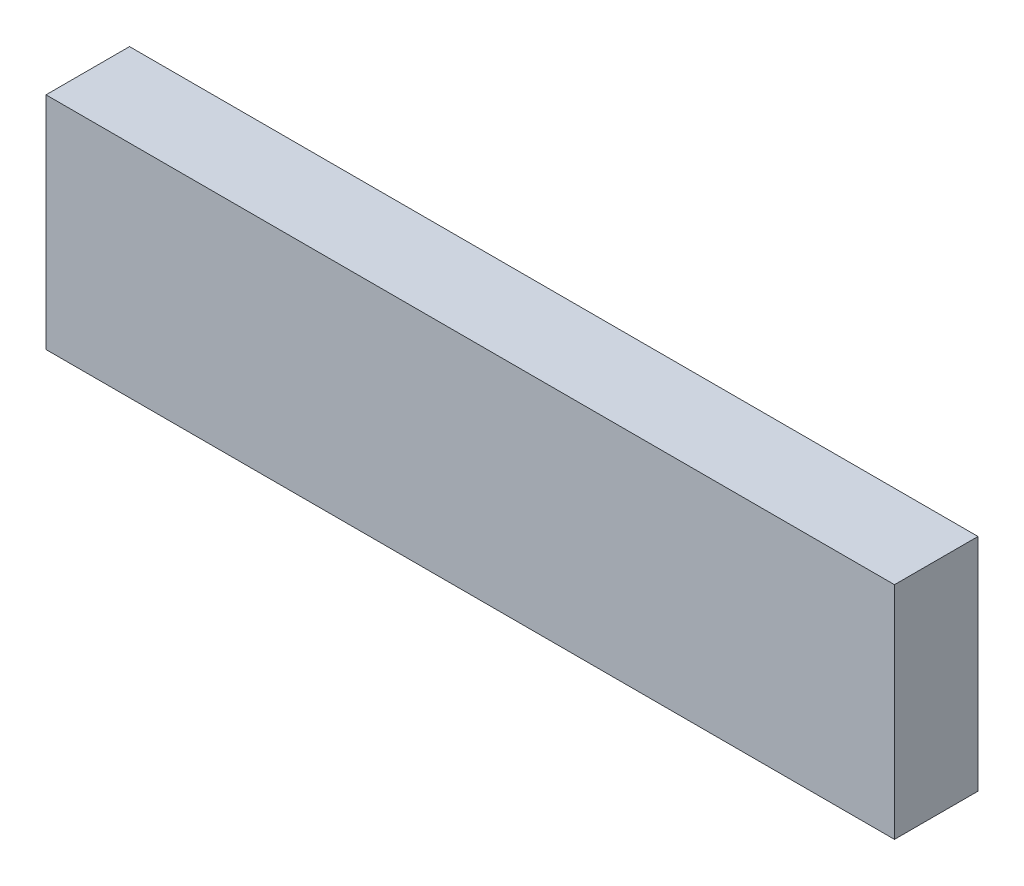
from build123d import *

# Parameters (mm, degrees)
ESQUISSE1_W             = 10.16
ESQUISSE1_H             = 2.6416
COMPONENT_OUTLINE_DEPTH = 1


with BuildPart() as part:
    # Esquisse1 → Component_Outline (new body)
    with BuildSketch(Plane.XY):
        with Locations((3.81, 0.0508)):
            Rectangle(ESQUISSE1_W, ESQUISSE1_H)
    extrude(amount=COMPONENT_OUTLINE_DEPTH)


solid = part.part
